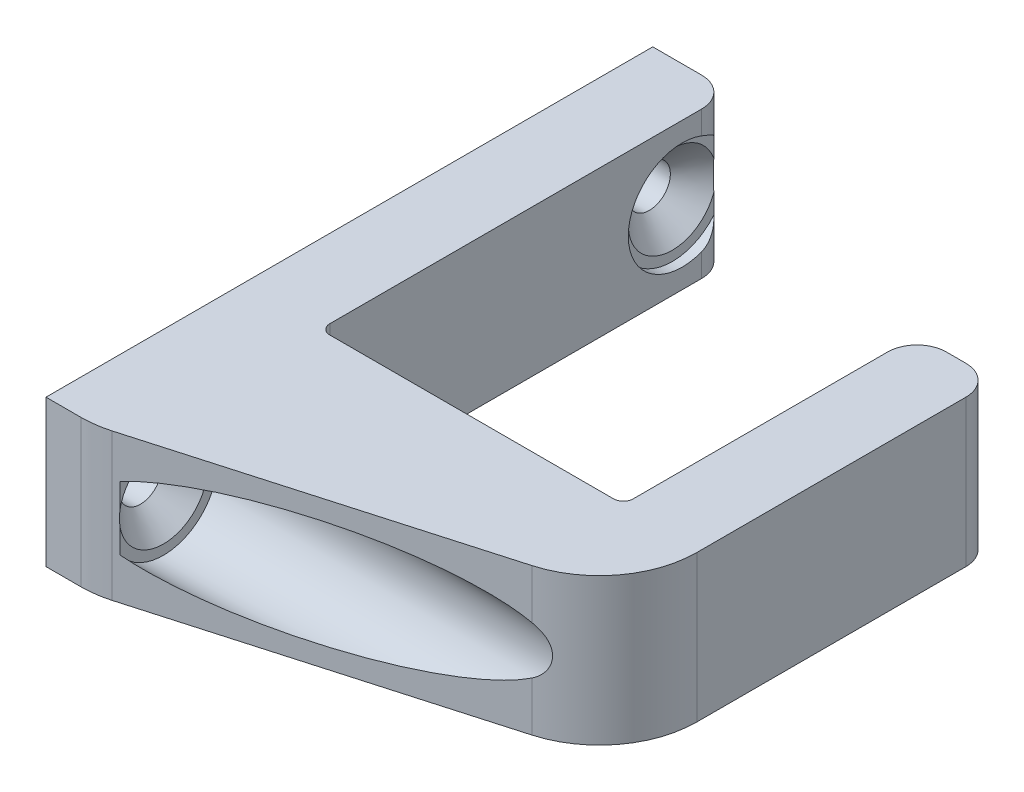
from build123d import *

# Parameters (mm, degrees)
BOSS_EXTRU_1_DEPTH                           = 7.5
CONG_1_R                                     = 1
CONG_2_R                                     = 10
CONG_3_R                                     = 3
CHAMBRAGE_POUR_VIS_T_TE_CYLINDRIQUE_AT_COUNT = 2
CHAMBRAGE_POUR_VIS_T_TE_CYLINDRIQUE_AT_PITCH = 52


with BuildPart() as part:
    # Esquisse1 → Boss.-Extru.1 (new, symmetric)
    with BuildSketch(Plane(origin=(0, 0, 0), x_dir=(1, 0, 0), z_dir=(0, 1, 0))):
        Polygon((0, 0), (0, 42), (-8, 42), (-8, -20), (-3, -20), (39, -8), (39, 30), (31, 30), (31, 0), align=None)
    extrude(amount=BOSS_EXTRU_1_DEPTH, both=True)

    # Congé1
    cong_1_edges = [part.edges().sort_by_distance(p)[0] for p in [
        (31, 0, 0),
        (0, 0, 0),
    ]]
    fillet(cong_1_edges, radius=CONG_1_R)

    # Congé2
    cong_2_edges = [part.edges().sort_by_distance(p)[0] for p in [
        (39, 0, 8),
        (-3, 0, 20),
    ]]
    fillet(cong_2_edges, radius=CONG_2_R)

    # Congé3
    cong_3_edges = [part.edges().sort_by_distance(p)[0] for p in [
        (31, 0, -30),
        (39, 0, -30),
        (0, 0, -42),
    ]]
    fillet(cong_3_edges, radius=CONG_3_R)

    # Esquisse2 → Chambrage pour vis à tête cylindrique à 6 pans creux (ou vis CHC) M41 (revolve, cut)
    with BuildSketch(Plane(origin=(0, 0, -37), x_dir=(0, 0, -1), z_dir=(0, 1, 0))):
        Polygon((0, 0), (0, 8), (2.15, 8), (2.15, 3.35), (4.5, 1), (5.5, 1), (5.5, 0), (5.5, -39), (0, -39), align=None)
    chambrage_pour_vis_t_te_cylindrique = revolve(axis=Axis((6.35, 0, -37), (-1, 0, 0)), mode=Mode.SUBTRACT)

    # Chambrage pour vis à tête cylindrique à 6 pans creux (ou vis CHC) M41 at: Chambrage pour vis à tête cylindrique à 6 pans creux (ou vis CHC) M41 ×2
    with Locations(*[(0, 0, i * CHAMBRAGE_POUR_VIS_T_TE_CYLINDRIQUE_AT_PITCH) for i in range(1, CHAMBRAGE_POUR_VIS_T_TE_CYLINDRIQUE_AT_COUNT)]):
        add(chambrage_pour_vis_t_te_cylindrique, mode=Mode.SUBTRACT)


solid = part.part
